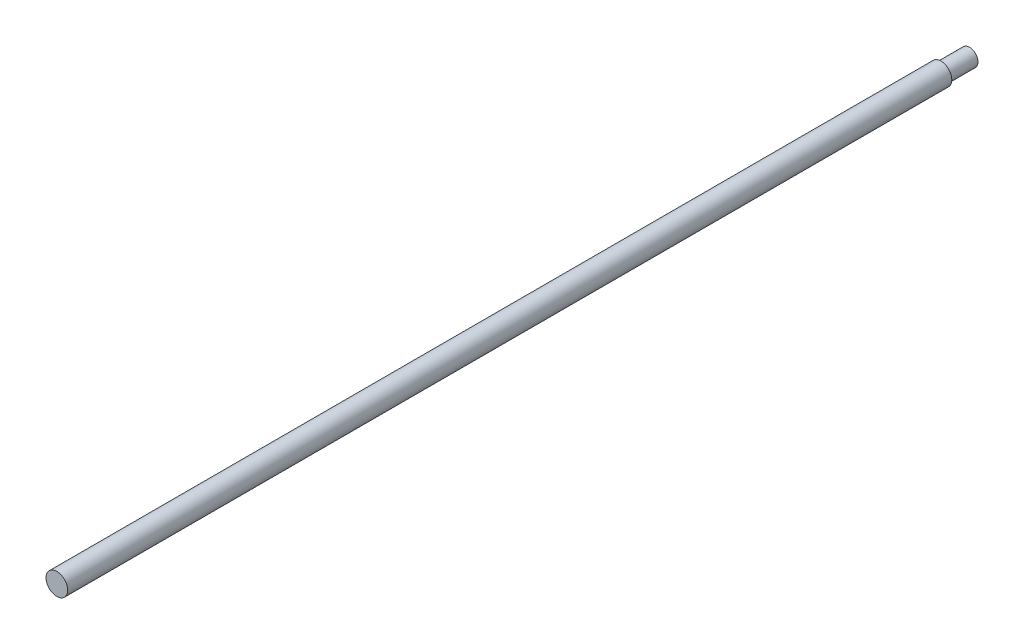
from build123d import *

# Parameters (mm, degrees)
SKETCH1_R           = 3.8
BOSS_EXTRUDE1_DEPTH = 320
SKETCH2_OUTSIDE_W   = 73.636
SKETCH2_OUTSIDE_H   = 73.636
SKETCH2_OUTSIDE_R   = 3
CUT_EXTRUDE1_DEPTH  = 10


with BuildPart() as part:
    # Sketch1 → Boss-Extrude1 (new body)
    with BuildSketch(Plane.XY):
        Circle(SKETCH1_R)
    extrude(amount=BOSS_EXTRUDE1_DEPTH)

    # Sketch2 outside → Cut-Extrude1 (cut)
    with BuildSketch(Plane(origin=(0, 0, 0), x_dir=(-1, 0, 0), z_dir=(0, 0, -1))):
        Rectangle(SKETCH2_OUTSIDE_W, SKETCH2_OUTSIDE_H)
        Circle(SKETCH2_OUTSIDE_R, mode=Mode.SUBTRACT)
    extrude(amount=-CUT_EXTRUDE1_DEPTH, mode=Mode.SUBTRACT)


solid = part.part
